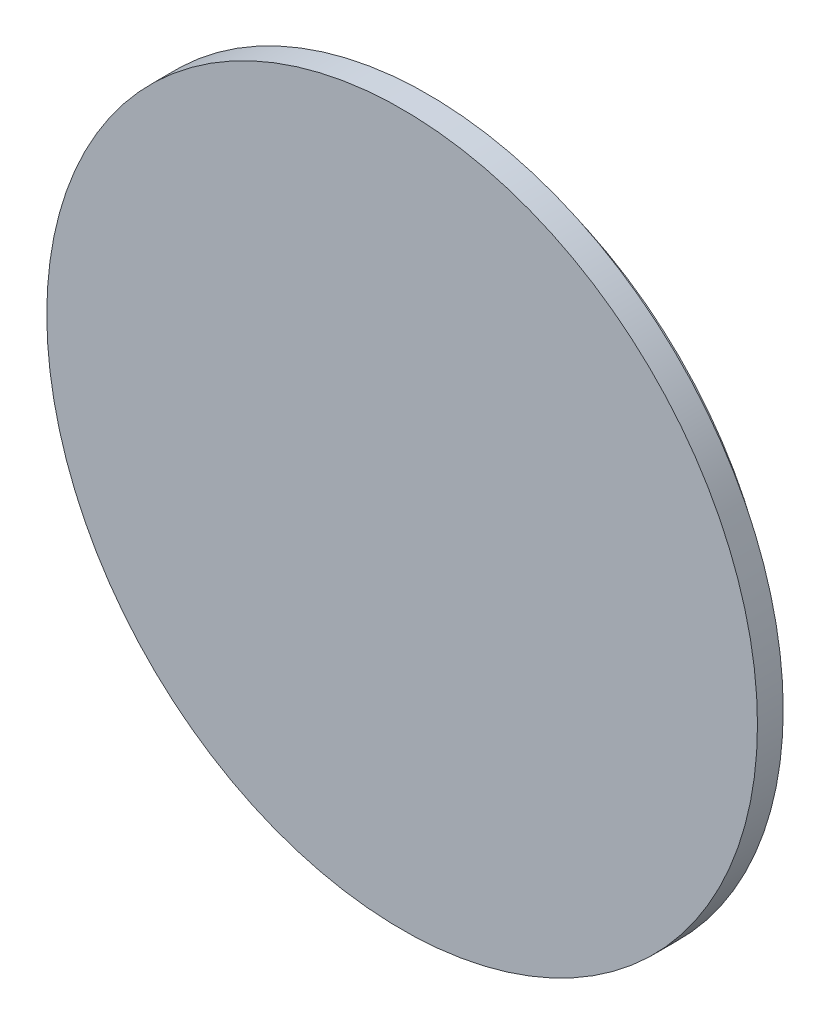
from build123d import *

# Parameters (mm, degrees)
SKETCH1_R               = 34.5
BOSS_EXTRUDE1_DEPTH     = 4.5
SKETCH2_W               = 2.65
SKETCH2_H               = 2
CUT_EXTRUDE1_DEPTH      = 49.997448913
CUT_EXTRUDE1_DEPTH_BACK = 49.997448913
SKETCH4_W               = 1.55
SKETCH4_H               = 1.5


with BuildPart() as part:
    # Sketch1 → Boss-Extrude1 (new body)
    with BuildSketch(Plane.XY):
        Circle(SKETCH1_R)
    extrude(amount=BOSS_EXTRUDE1_DEPTH)

    # Sketch2 → Cut-Revolve1 (revolve, cut)
    with BuildSketch(Plane(origin=(0, 0, 0), x_dir=(1, 0, 0), z_dir=(0, 1, 0)), mode=Mode.PRIVATE) as cut_revolve1_sk:
        with Locations((33.175, -1)):
            Rectangle(SKETCH2_W, SKETCH2_H)
    revolve(cut_revolve1_sk.sketch.rotate(Axis((0, 0, 0), (0, 0, 1)), 180), axis=Axis((0, 0, 0), (0, 0, 1)), mode=Mode.SUBTRACT)

    # Sketch4 → Cut-Extrude1 (cut, two sides: drawn at the far end of the back side and taken through both)
    with BuildSketch(Plane(origin=(0, 0, 0), x_dir=(1, 0, 0), z_dir=(0, 1, 0)).offset(-CUT_EXTRUDE1_DEPTH_BACK)):
        with Locations((0, -0.75)):
            Rectangle(SKETCH4_W, SKETCH4_H)
    extrude(amount=CUT_EXTRUDE1_DEPTH + CUT_EXTRUDE1_DEPTH_BACK, mode=Mode.SUBTRACT)


solid = part.part
